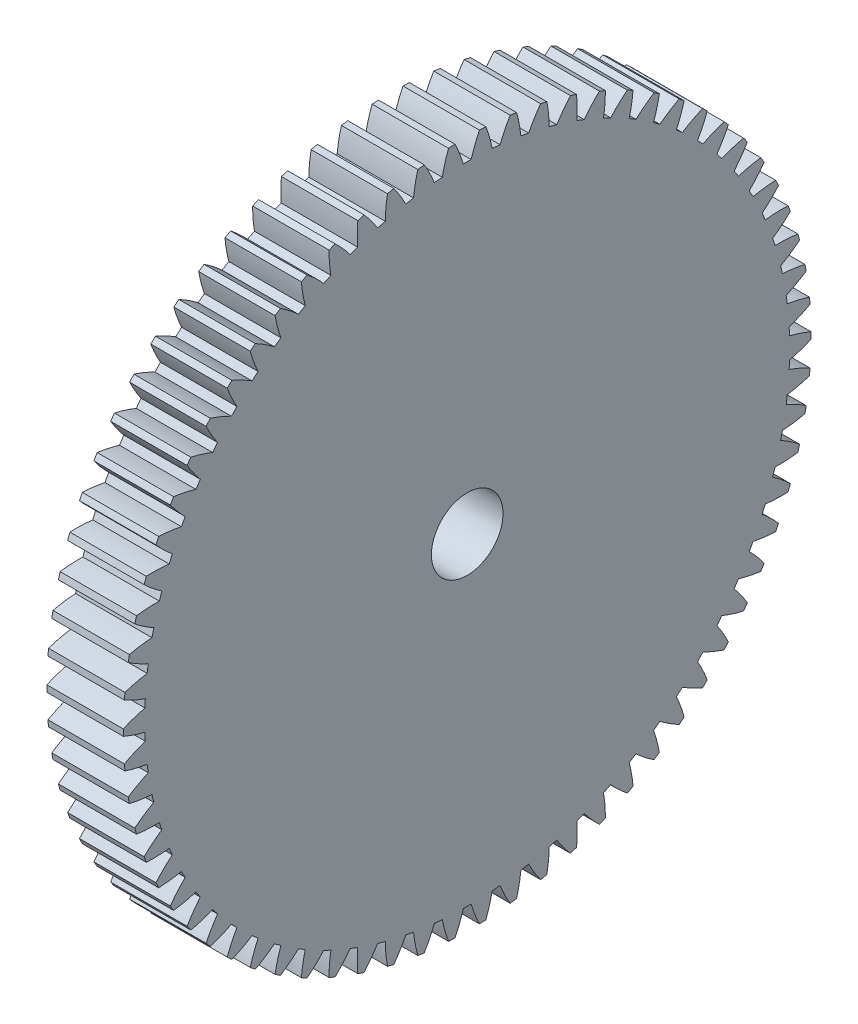
from build123d import *

# Parameters (mm, degrees)
BASPROSKE_W     = 32
BASPROSKE_H     = 144
TOOTHCUT_DEPTH  = 207.145579628
TEETHCUTS_COUNT = 70
TEETHCUTS_ANGLE = 354.857142857
BORSKE_R        = 15
BORE_DEPTH      = 50.0000508


with BuildPart() as part:
    # BasProSke → Base-Revolve (revolve)
    with BuildSketch(Plane(origin=(0, 0, 0), x_dir=(1, 0, 0), z_dir=(0, 1, 0)), mode=Mode.PRIVATE) as base_revolve_sk:
        with Locations((16, 72)):
            Rectangle(BASPROSKE_W, BASPROSKE_H)
    revolve(base_revolve_sk.sketch.rotate(Axis((-10, 0, 0), (1, 0, 0)), 180), axis=Axis((-10, 0, 0), (1, 0, 0)))

    # TooCutSke → ToothCut (cut, through all)
    with BuildSketch(Plane(origin=(0, 0, 0), x_dir=(0, 0, -1), z_dir=(1, 0, 0))):
        with BuildLine():
            ThreePointArc((1.657468947, 134.988824714), (0, 134.999), (-1.657468947, 134.988824714))
            ThreePointArc((-1.657468947, 134.988824714), (-3.197517868, 139.535877203), (-5.121359626, 143.934316689))
            ThreePointArc((-5.121359626, 143.934316689), (0, 144.0254), (5.121359626, 143.934316689))
            ThreePointArc((5.121359626, 143.934316689), (3.197517868, 139.535877203), (1.657468947, 134.988824714))
        make_face()
    toothcut = extrude(amount=TOOTHCUT_DEPTH, mode=Mode.SUBTRACT)

    # TeethCuts: ToothCut ×70 about axis
    teethcuts_axis = Axis((-10, 0, 0), (1, 0, 0))
    for i in range(1, TEETHCUTS_COUNT):
        add(toothcut.rotate(teethcuts_axis, i * TEETHCUTS_ANGLE / (TEETHCUTS_COUNT - 1)), mode=Mode.SUBTRACT)

    # BorSke → Bore (cut, symmetric)
    with BuildSketch(Plane(origin=(0, 0, 0), x_dir=(0, 0, -1), z_dir=(1, 0, 0))):
        with Locations(Location((0, 0, 0), (0, 0, 180))):
            Circle(BORSKE_R)
    extrude(amount=BORE_DEPTH, both=True, mode=Mode.SUBTRACT)


solid = part.part
